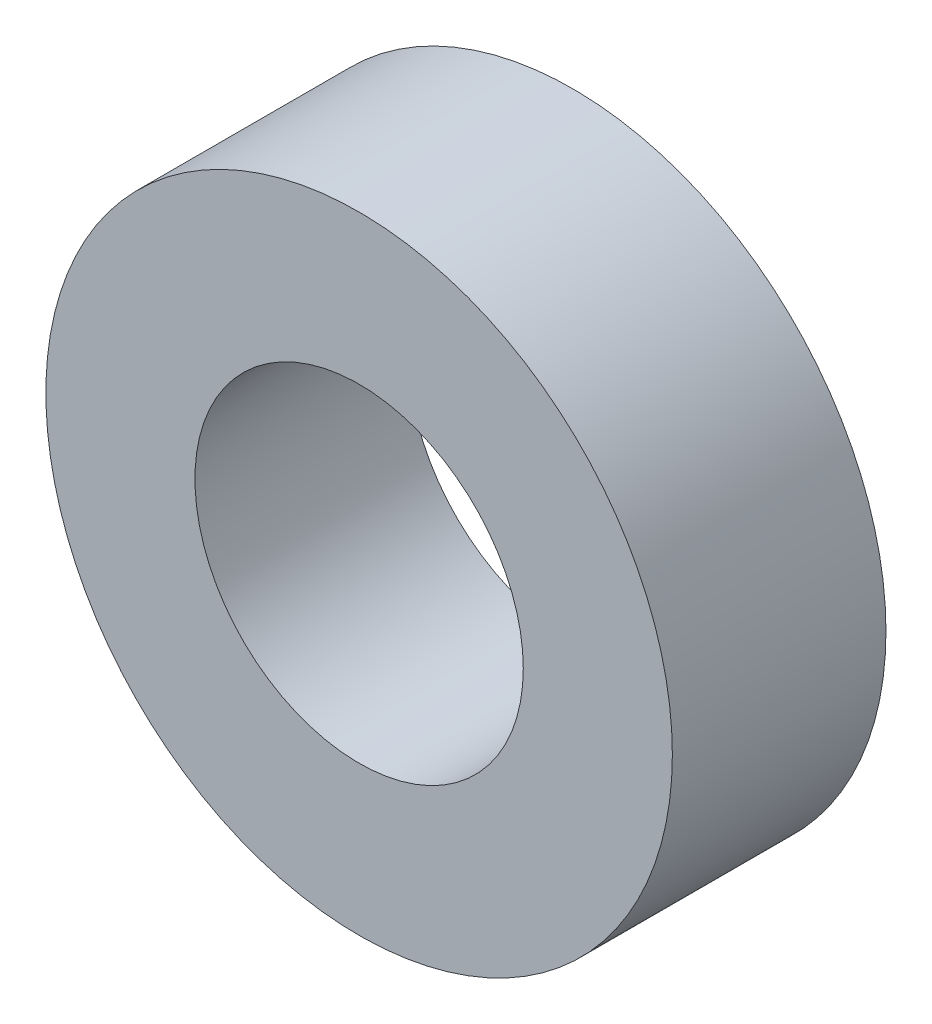
from build123d import *

# Parameters (mm, degrees)
ESQUISSE1_R        = 7.89
ESQUISSE1_R_2      = 4.135
BOSS_EXTRU_1_DEPTH = 5.38


with BuildPart() as part:
    # Esquisse1 → Boss.-Extru.1 (new body)
    with BuildSketch(Plane(origin=(0, 0, 0), x_dir=(0, 1, 0), z_dir=(0, 0, 1))):
        with Locations(Location((0, 0, 0), (0, 0, 270))):
            Circle(ESQUISSE1_R)
        with Locations(Location((0, 0, 0), (0, 0, 270))):
            Circle(ESQUISSE1_R_2, mode=Mode.SUBTRACT)
    extrude(amount=BOSS_EXTRU_1_DEPTH)


solid = part.part
